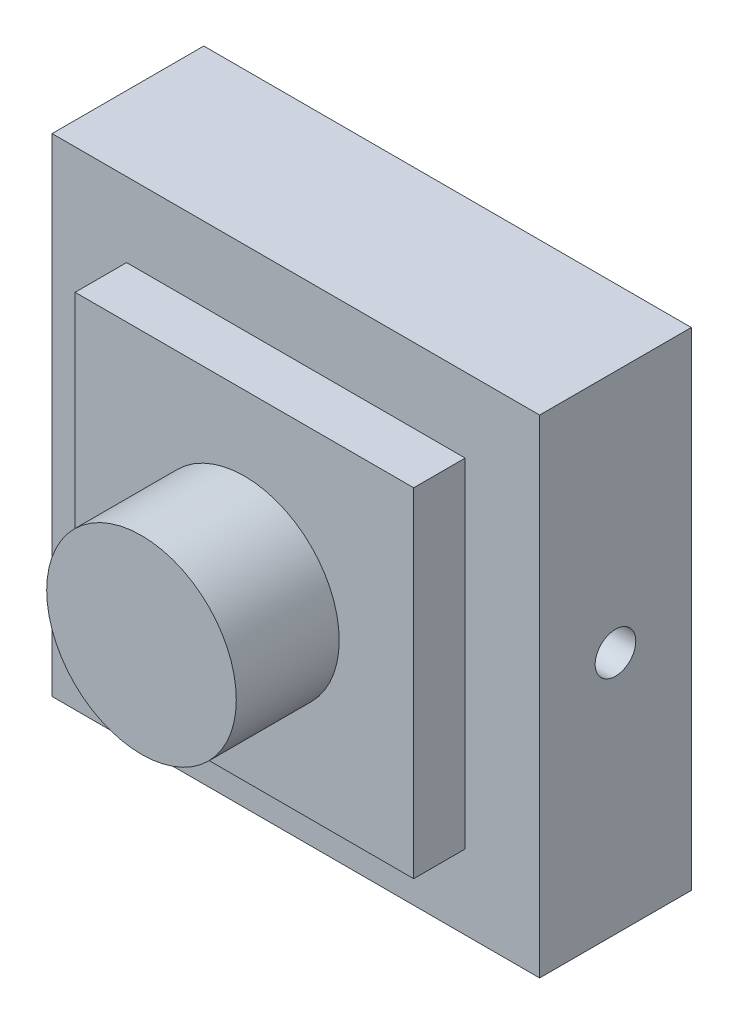
from build123d import *

# Parameters (mm, degrees)
SKETCH_2_W      = 36
SKETCH_2_H      = 36
EXTRUDE_1_DEPTH = 11.2
SKETCH_3_W      = 25
SKETCH_3_H      = 25
EXTRUDE_2_DEPTH = 3.8
SKETCH_4_R      = 7
EXTRUDE_3_DEPTH = 7.6


with BuildPart() as part:
    # 草图2 → 凸台-拉伸1 (new body)
    with BuildSketch(Plane.XY):
        Rectangle(SKETCH_2_W, SKETCH_2_H)
    extrude(amount=EXTRUDE_1_DEPTH)

    # 草图3 → 凸台-拉伸2 (add)
    with BuildSketch(Plane.XY.offset(11.2)):
        Rectangle(SKETCH_3_W, SKETCH_3_H)
    extrude(amount=EXTRUDE_2_DEPTH)

    # 草图4 → 凸台-拉伸3 (add)
    with BuildSketch(Plane.XY.offset(15)):
        with Locations(Location((0, 0, 0), (0, 0, 180))):
            Circle(SKETCH_4_R)
    extrude(amount=EXTRUDE_3_DEPTH)

    # 草图6 → M3 螺纹孔1 (revolve, cut)
    with BuildSketch(Plane(origin=(-18, 0, 5.6), x_dir=(0, 0, 1), z_dir=(0, 1, 0))):
        Polygon((0, 0), (0, 8.251075774), (1.25, 7.5), (1.25, 6), (1.5, 6), (1.5, 0), align=None)
    hole_wizard_m3_1 = revolve(axis=Axis((-24.35, 0, 5.6), (1, 0, 0)), mode=Mode.SUBTRACT)

    # 镜向1: M3 螺纹孔1 across plane
    add(hole_wizard_m3_1.mirror(Plane(origin=(0, 0, 0), x_dir=(0, 0, 1), z_dir=(1, 0, 0))), mode=Mode.SUBTRACT)


solid = part.part
